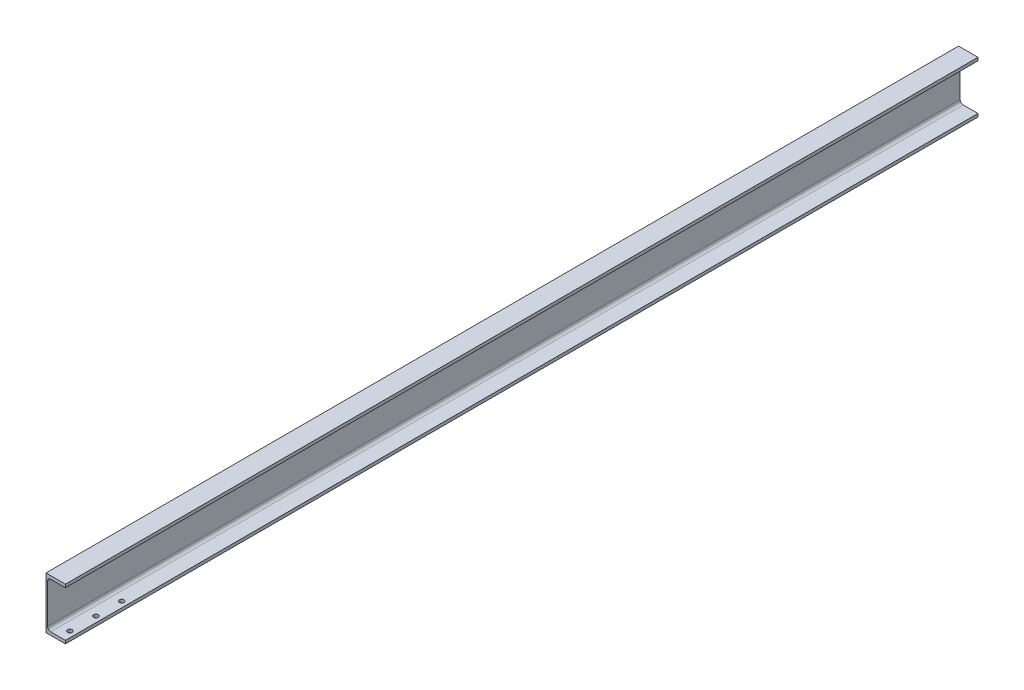
from build123d import *

# Parameters (mm, degrees)
BOSS_EXTRUDE1_DEPTH = 1762.5
CUT_EXTRUDE1_REACH  = 1777.396
SKETCH2_R           = 9


with BuildPart() as part:
    # Sketch1 → Boss-Extrude1 (new, symmetric)
    with BuildSketch(Plane.XY):
        with BuildLine():
            Line((0, 100), (0, -100))
            Line((0, -100), (75, -100))
            Line((75, -100), (75, -88))
            Line((75, -88), (18, -88))
            ThreePointArc((18, -88), (9.514718626, -84.485281374), (6, -76))
            Line((6, -76), (6, 76))
            ThreePointArc((6, 76), (9.514718626, 84.485281374), (18, 88))
            Line((18, 88), (75, 88))
            Line((75, 88), (75, 100))
            Line((75, 100), (0, 100))
        make_face()
    extrude(amount=BOSS_EXTRUDE1_DEPTH, both=True)

    # Sketch2 → Cut-Extrude1 (cut, up to next)
    with BuildSketch(Plane.XZ.offset(100), mode=Mode.PRIVATE) as cut_extrude1_sk1:
        with Locations(Location((52.5, 1722.5, 0), (0, 0, 270))):
            Circle(SKETCH2_R)
    cut_extrude1_tool1 = extrude(cut_extrude1_sk1.sketch, amount=-CUT_EXTRUDE1_REACH, mode=Mode.PRIVATE) & part.part
    # Sketch2 → Cut-Extrude1 (cut, up to next)
    with BuildSketch(Plane.XZ.offset(100), mode=Mode.PRIVATE) as cut_extrude1_sk2:
        with Locations(Location((52.5, 1622.5, 0), (0, 0, 270))):
            Circle(SKETCH2_R)
    cut_extrude1_tool2 = extrude(cut_extrude1_sk2.sketch, amount=-CUT_EXTRUDE1_REACH, mode=Mode.PRIVATE) & part.part
    # Sketch2 → Cut-Extrude1 (cut, up to next)
    with BuildSketch(Plane.XZ.offset(100), mode=Mode.PRIVATE) as cut_extrude1_sk3:
        with Locations(Location((52.5, 1522.5, 0), (0, 0, 270))):
            Circle(SKETCH2_R)
    cut_extrude1_tool3 = extrude(cut_extrude1_sk3.sketch, amount=-CUT_EXTRUDE1_REACH, mode=Mode.PRIVATE) & part.part
    add(cut_extrude1_tool1.solids().sort_by_distance((52.5, -100, 1722.5))[0], mode=Mode.SUBTRACT)
    add(cut_extrude1_tool2.solids().sort_by_distance((52.5, -100, 1622.5))[0], mode=Mode.SUBTRACT)
    add(cut_extrude1_tool3.solids().sort_by_distance((52.5, -100, 1522.5))[0], mode=Mode.SUBTRACT)


solid = part.part
